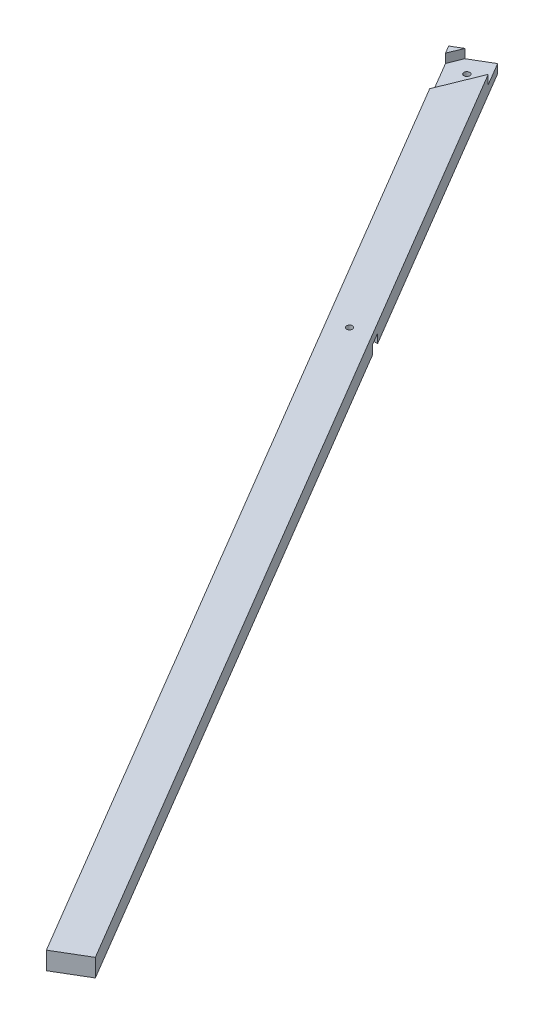
from build123d import *

# Parameters (mm, degrees)
BOSS_EXTRUDE4_DEPTH = 19.05
CUT_EXTRUDE5_DEPTH  = 9.525
CUT_EXTRUDE6_DEPTH  = 9.525
SKETCH10_R          = 3.175
CUT_EXTRUDE7_DEPTH  = 19.05


with BuildPart() as part:
    # Sketch2 → Boss-Extrude4 (new body)
    with BuildSketch(Plane(origin=(0, 0, 0), x_dir=(1, 0, 0), z_dir=(0, 1, 0))):
        Polygon((-183.626593256, 296.748681841), (-193.321682542, 313.147088585), (-226.11849603, 293.756910013), (-52.443119188, 0), (-29.917583168, -38.1), (394.367218256, -755.741121604), (427.164031744, -736.350943032), (0, -13.839851848), (-8.182416832, 0), align=None)
    extrude(amount=BOSS_EXTRUDE4_DEPTH)

    # Sketch8 → Cut-Extrude5 (cut)
    with BuildSketch(Plane(origin=(0, 19.05, 0), x_dir=(1, 0, 0), z_dir=(0, 1, 0))):
        Polygon((-193.321682542, 313.147088585), (-215.267964049, 300.171976915), (-221.216787177, 285.466092555), (-196.814123155, 244.191092555), (-178.833212823, 288.641092555), align=None)
    extrude(amount=-CUT_EXTRUDE5_DEPTH, mode=Mode.SUBTRACT)

    # Sketch9 → Cut-Extrude6 (cut)
    with BuildSketch(Plane.XZ):
        Polygon((-52.443119188, 0), (-29.917583168, 38.1), (0, 38.1), (0, 13.839851848), (-8.182416832, 0), align=None)
    extrude(amount=-CUT_EXTRUDE6_DEPTH, mode=Mode.SUBTRACT)

    # Sketch10 → Cut-Extrude7 (cut)
    with BuildSketch(Plane.XZ):
        with Locations(Location((-200.025, -287.053592555, 0), (0, 0, 270))):
            Circle(SKETCH10_R)
        with Locations(Location((-19.05, 19.05, 0), (0, 0, 270))):
            Circle(SKETCH10_R)
    extrude(amount=-CUT_EXTRUDE7_DEPTH, mode=Mode.SUBTRACT)


solid = part.part
